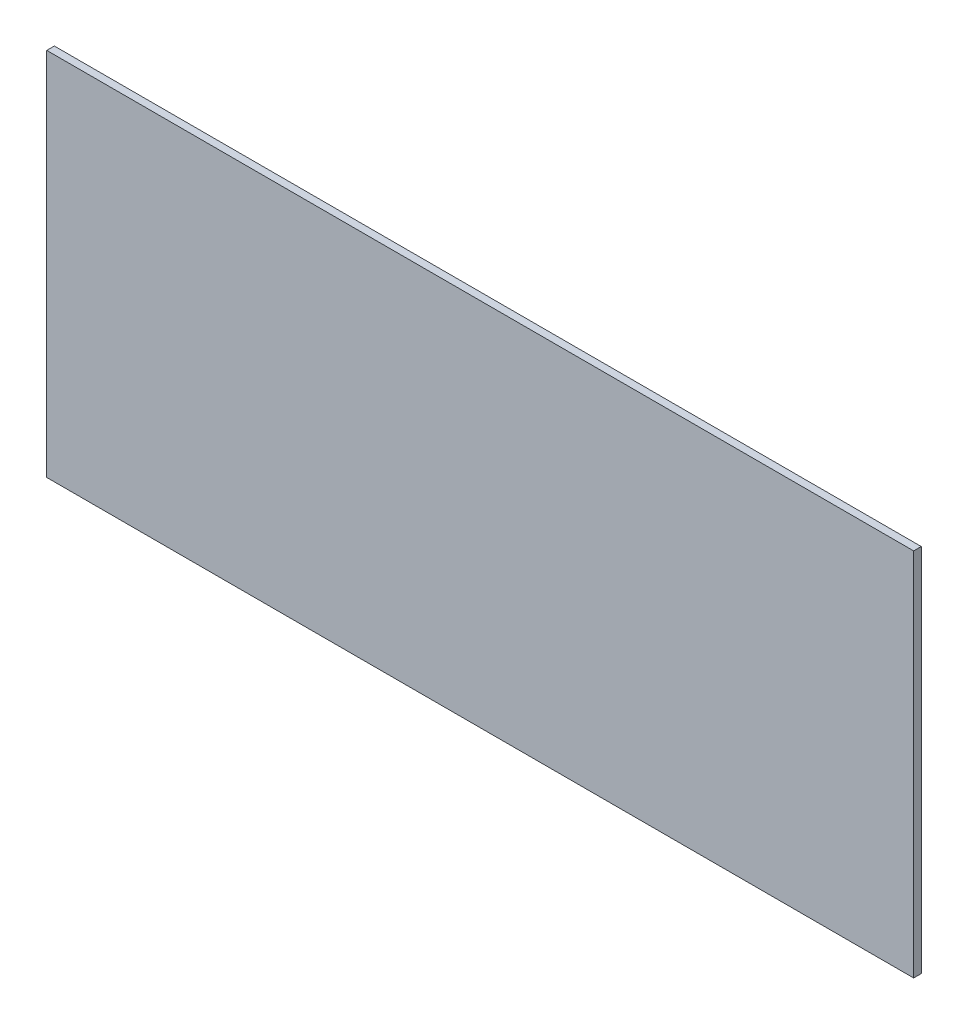
from build123d import *

# Parameters (mm, degrees)
CROQUIS2_W              = 114.3
CROQUIS2_H              = 48.768
SALIENTE_EXTRUIR1_DEPTH = 0.5


with BuildPart() as part:
    # Croquis2 → Saliente-Extruir1 (new, symmetric)
    with BuildSketch(Plane.XY):
        Rectangle(CROQUIS2_W, CROQUIS2_H)
    extrude(amount=SALIENTE_EXTRUIR1_DEPTH, both=True)


solid = part.part
